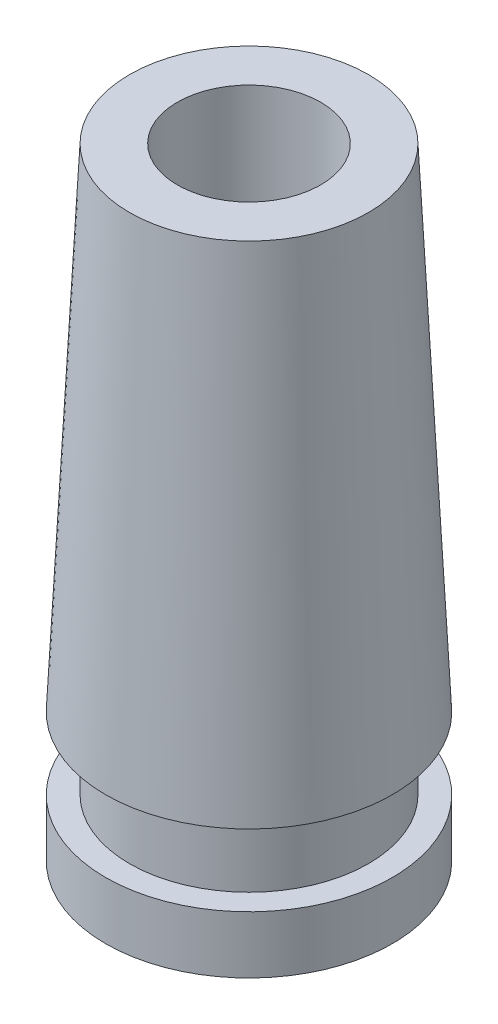
from build123d import *


with BuildPart() as part:
    # Esquisse1 → Révolution1 (revolve)
    with BuildSketch(Plane.XY, mode=Mode.PRIVATE) as r_volution1_sk:
        Polygon((-1.5, 0), (-3, 0), (-3, 1.2), (-2.5, 1.2), (-2.5, 2.7), (-3, 2.7), (-2.5, 13), (-1.5, 13), align=None)
    revolve(r_volution1_sk.sketch.rotate(Axis((0, 0, 0), (0, 1, 0)), 270), axis=Axis((0, 0, 0), (0, 1, 0)))


solid = part.part
